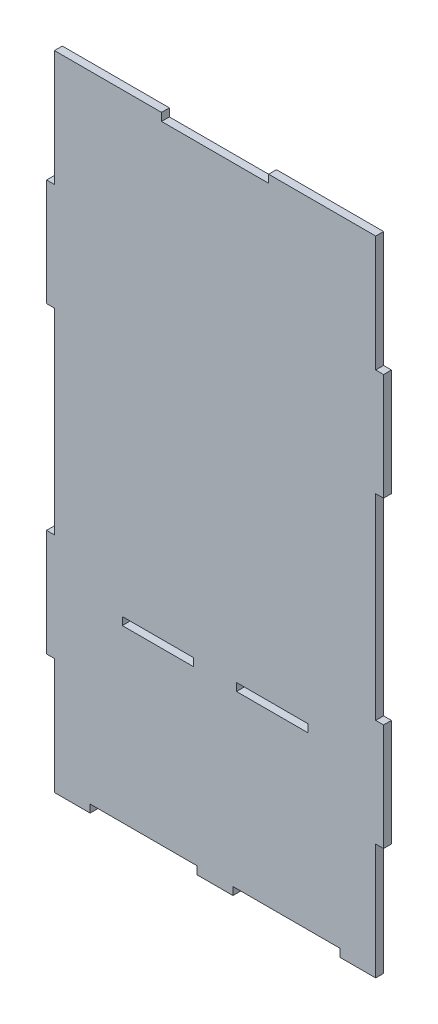
from build123d import *

# Parameters (mm, degrees)
SKETCH1_W               = 228.6
SKETCH1_H               = 457.2
BOSS_EXTRUDE1_DEPTH     = 5.588
SKETCH2_W               = 5.588
SKETCH2_H               = 76.2
BOSS_EXTRUDE4_DEPTH     = 5.588
SKETCH3_W               = 76.2
SKETCH3_H               = 5.588
CUT_EXTRUDE1_DEPTH      = 5.588
CUT_EXTRUDE5_DEPTH      = 341.842806914
CUT_EXTRUDE5_DEPTH_BACK = 341.842806914
SKETCH4_W               = 50.8
SKETCH4_H               = 5.588


with BuildPart() as part:
    # Sketch1 → Boss-Extrude1 (new body)
    with BuildSketch(Plane.XY):
        with Locations((-78.307659574, -48.638297872)):
            Rectangle(SKETCH1_W, SKETCH1_H)
    extrude(amount=BOSS_EXTRUDE1_DEPTH)

    # Sketch2 → Boss-Extrude4 (add, through all)
    with BuildSketch(Plane.XY.offset(5.588)):
        with Locations((-195.401659574, 59.311702128)):
            Rectangle(SKETCH2_W, SKETCH2_H)
        with Locations((-195.401659574, -156.588297872)):
            Rectangle(SKETCH2_W, SKETCH2_H)
        with Locations((38.786340426, -156.588297872)):
            Rectangle(SKETCH2_W, SKETCH2_H)
        with Locations((38.786340426, 59.311702128)):
            Rectangle(SKETCH2_W, SKETCH2_H)
    extrude(amount=-BOSS_EXTRUDE4_DEPTH)

    # Sketch3 → Cut-Extrude1 (cut)
    with BuildSketch(Plane.XY.offset(5.588)):
        with Locations((-129.107659574, -274.444297872)):
            Rectangle(SKETCH3_W, SKETCH3_H)
        with Locations((-27.507659574, -274.444297872)):
            Rectangle(SKETCH3_W, SKETCH3_H)
        with Locations((-78.307659574, 177.167702128)):
            Rectangle(SKETCH3_W, SKETCH3_H)
    extrude(amount=-CUT_EXTRUDE1_DEPTH, mode=Mode.SUBTRACT)

    # Sketch4 → Cut-Extrude5 (cut, two sides: drawn at the far end of the back side and taken through both)
    with BuildSketch(Plane.XY.offset(-CUT_EXTRUDE5_DEPTH_BACK)):
        with Locations((-118.947659574, -147.444297872)):
            Rectangle(SKETCH4_W, SKETCH4_H)
        with Locations((-37.667659574, -147.444297872)):
            Rectangle(SKETCH4_W, SKETCH4_H)
    extrude(amount=CUT_EXTRUDE5_DEPTH + CUT_EXTRUDE5_DEPTH_BACK, mode=Mode.SUBTRACT)


solid = part.part
